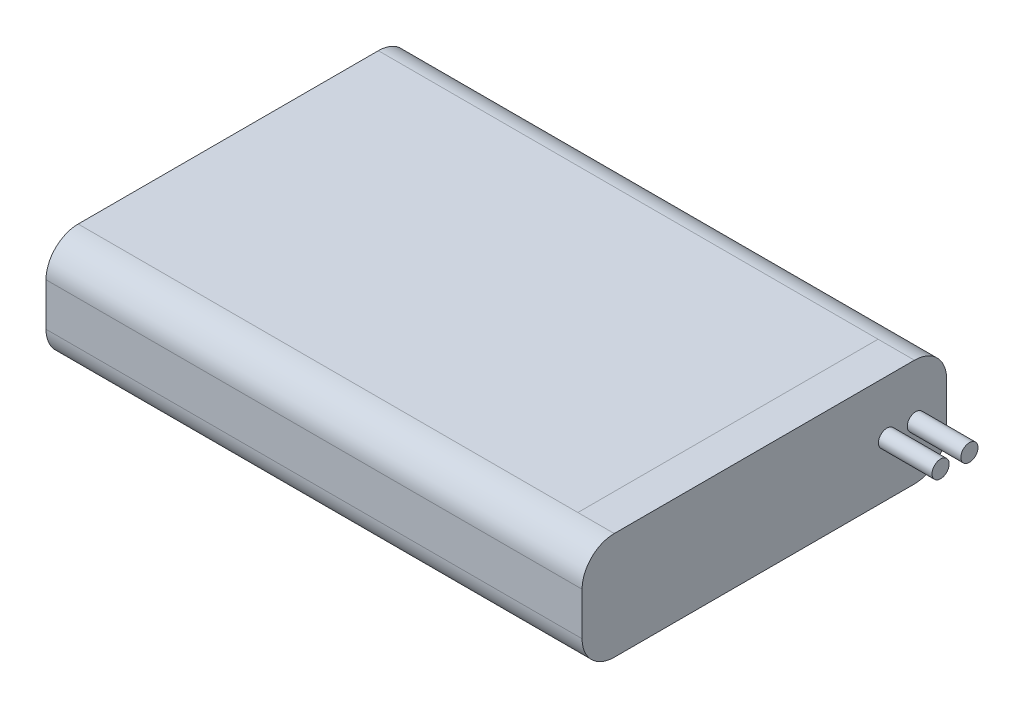
from build123d import *

# Parameters (mm, degrees)
EXTRUDE_2_DEPTH = 50
SKETCH_5_R      = 0.8
EXTRUDE_4_DEPTH = 5
SKETCH_6_R      = 0.8
EXTRUDE_5_DEPTH = 5
SKETCH_7_W      = 3.391372173
SKETCH_7_H      = 28
EXTRUDE_6_DEPTH = 0.0001
SKETCH_8_W      = 3.391372173
SKETCH_8_H      = 28
EXTRUDE_7_DEPTH = 0.0001


with BuildPart() as part:
    # 草图1 → 凸台-拉伸2 (new body)
    with BuildSketch(Plane(origin=(0, 0, 0), x_dir=(0, 0, -1), z_dir=(1, 0, 0))):
        with BuildLine():
            Line((-13.81021057, -5.282067654), (14.18978943, -5.282067654))
            ThreePointArc((14.18978943, -5.282067654), (16.311109773, -4.403387998), (17.18978943, -2.282067654))
            Line((17.18978943, -2.282067654), (17.18978943, 1.717932346))
            ThreePointArc((17.18978943, 1.717932346), (16.311109773, 3.839252689), (14.18978943, 4.717932346))
            Line((14.18978943, 4.717932346), (-13.81021057, 4.717932346))
            ThreePointArc((-13.81021057, 4.717932346), (-15.931530914, 3.839252689), (-16.81021057, 1.717932346))
            Line((-16.81021057, 1.717932346), (-16.81021057, -2.282067654))
            ThreePointArc((-16.81021057, -2.282067654), (-15.931530914, -4.403387998), (-13.81021057, -5.282067654))
        make_face()
    extrude(amount=EXTRUDE_2_DEPTH)

    # 草图5 → 凸台-拉伸4 (add)
    with BuildSketch(Plane(origin=(50, 0, 0), x_dir=(0, 0, -1), z_dir=(1, 0, 0))):
        with Locations(Location((11.628905856, -0.282922759, 0), (0, 0, 180))):
            Circle(SKETCH_5_R)
    extrude(amount=EXTRUDE_4_DEPTH)

    # 草图6 → 凸台-拉伸5 (add)
    with BuildSketch(Plane(origin=(50, 0, 0), x_dir=(0, 0, -1), z_dir=(1, 0, 0))):
        with Locations(Location((14.317760306, -0.301594573, 0), (0, 0, 180))):
            Circle(SKETCH_6_R)
    extrude(amount=EXTRUDE_5_DEPTH)

    # 草图7 → 凸台-拉伸6 (add)
    with BuildSketch(Plane(origin=(0, 4.717932346, 0), x_dir=(1, 0, 0), z_dir=(0, 1, 0))):
        with Locations((48.304313913, 0.18978943)):
            Rectangle(SKETCH_7_W, SKETCH_7_H)
    extrude(amount=EXTRUDE_6_DEPTH)

    # 草图8 → 凸台-拉伸7 (add)
    with BuildSketch(Plane(origin=(0, -5.282067654, 0), x_dir=(-1, 0, 0), z_dir=(0, -1, 0))):
        with Locations((-48.304313913, 0.18978943)):
            Rectangle(SKETCH_8_W, SKETCH_8_H)
    extrude(amount=EXTRUDE_7_DEPTH)


solid = part.part
